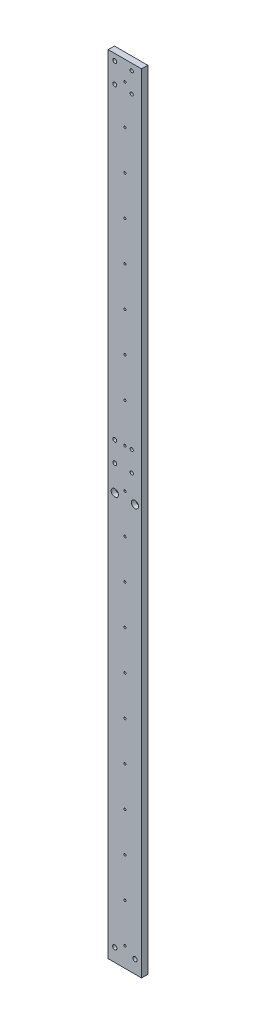
from build123d import *

# Parameters (mm, degrees)
SKETCH1_W                      = 50.8
SKETCH1_H                      = 1200
EXTRUDE1_DEPTH                 = 4.7625
M4X0_7_TAPPED_HOLE1_D          = 3.3
M6_CLEARANCE_HOLE1_D           = 6.6
CBORE_FOR_M6_SHCS1_D           = 6.6
CBORE_FOR_M6_SHCS1_CBORE_D     = 11
CBORE_FOR_M6_SHCS1_CBORE_DEPTH = 6.8
F_6_0_6_DIAMETER_HOLE2_D       = 6
M6X1_0_TAPPED_HOLE1_D          = 5


with BuildPart() as part:
    # Sketch1 → Extrude1 (new, symmetric)
    with BuildSketch(Plane.XY):
        Rectangle(SKETCH1_W, SKETCH1_H)
    extrude(amount=EXTRUDE1_DEPTH, both=True)

    # M4x0.7 Tapped Hole1 (through all)
    with Locations(Plane.XY.offset(4.7625)):
        with Locations((0, 570), (0, 510), (0, 450), (0, 390), (0, 330), (0, 270), (0, 150), (0, 210), (0, 90), (0, 30), (0, -30), (0, -90), (0, -150), (0, -210), (0, -270), (0, -330), (0, -390), (0, -450), (0, -510), (0, -570)):
            Hole(M4X0_7_TAPPED_HOLE1_D / 2)

    # M6 Clearance Hole1 (through all)
    with Locations(Plane.XY.offset(4.7625)):
        with Locations((-15.4, -580), (15.4, -580)):
            Hole(M6_CLEARANCE_HOLE1_D / 2)

    # CBORE for M6 SHCS1 (through all)
    with Locations(Plane.XY.offset(4.7625)):
        with Locations((15.4, 20), (-15.4, 20)):
            CounterBoreHole(CBORE_FOR_M6_SHCS1_D / 2, CBORE_FOR_M6_SHCS1_CBORE_D / 2, CBORE_FOR_M6_SHCS1_CBORE_DEPTH)

    # Ø6.0 (6) Diameter Hole2 (through all)
    with Locations(Plane(origin=(0, 0, -4.7625), x_dir=(-1, 0, 0), z_dir=(0, 0, -1))):
        with Locations((15.4, 590), (15.4, 559.2), (15.4, 90), (15.4, 59.2)):
            Hole(F_6_0_6_DIAMETER_HOLE2_D / 2)

    # M6x1.0 Tapped Hole1 (through all)
    with Locations(Plane(origin=(0, 0, -4.7625), x_dir=(-1, 0, 0), z_dir=(0, 0, -1))):
        with Locations((-10.4, 559.2), (-10.4, 590), (-10.4, 90), (-10.4, 59.2)):
            Hole(M6X1_0_TAPPED_HOLE1_D / 2)


solid = part.part
